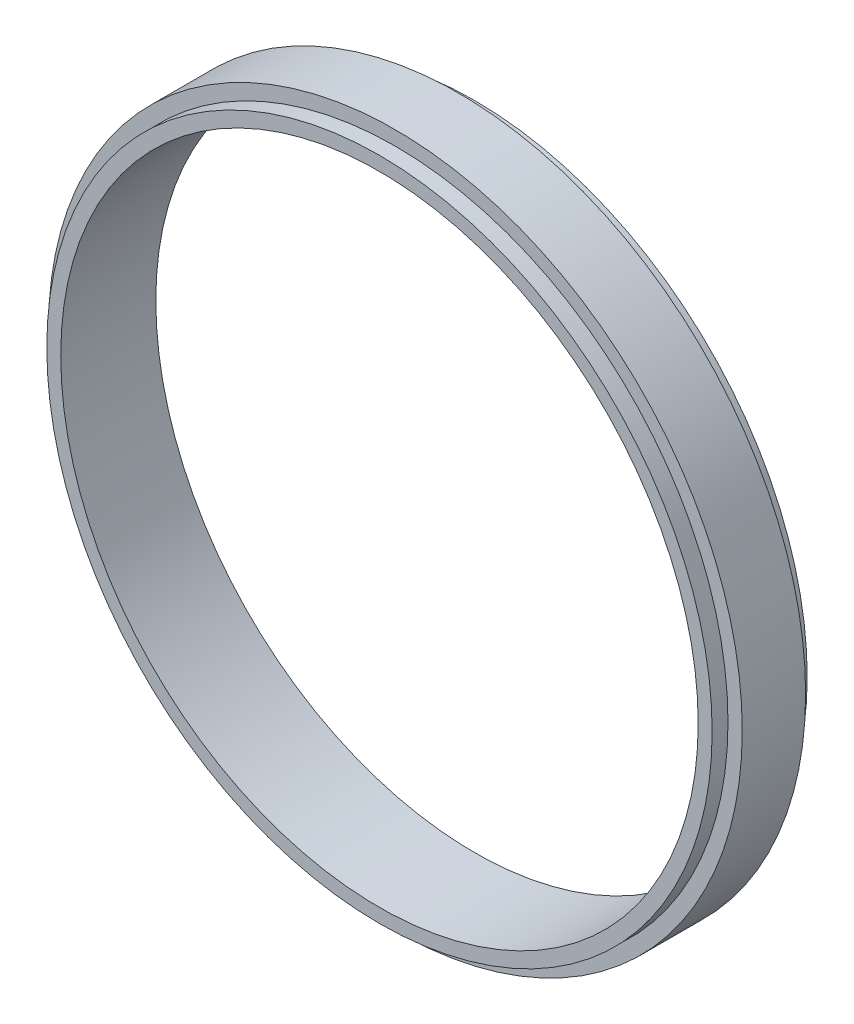
from build123d import *

# Parameters (mm, degrees)
S01_INNER_RACE_CONTACT_LIPS_R         = 21
S01_INNER_RACE_CONTACT_LIPS_R_2       = 20.12
F_01_INNER_RACE_CONTACT_LIPS_DEPTH    = 6
F_02_START                            = 1
S02_STIFFENED_MIDDLE_OF_SPACER_R      = 21.9
S02_STIFFENED_MIDDLE_OF_SPACER_R_2    = 20.12
F_02_STIFFENED_MIDDLE_OF_SPACER_DEPTH = 4


with BuildPart() as part:
    # S01 - Inner race contact lips → 01 - Inner race contact lips (new body)
    with BuildSketch(Plane.XY):
        Circle(S01_INNER_RACE_CONTACT_LIPS_R)
        Circle(S01_INNER_RACE_CONTACT_LIPS_R_2, mode=Mode.SUBTRACT)
    extrude(amount=F_01_INNER_RACE_CONTACT_LIPS_DEPTH)

    # S02 - Stiffened middle of spacer → 02 - Stiffened middle of spacer (add)
    with BuildSketch(Plane.XY.offset(F_02_START)):
        Circle(S02_STIFFENED_MIDDLE_OF_SPACER_R)
        Circle(S02_STIFFENED_MIDDLE_OF_SPACER_R_2, mode=Mode.SUBTRACT)
    extrude(amount=F_02_STIFFENED_MIDDLE_OF_SPACER_DEPTH)


solid = part.part
